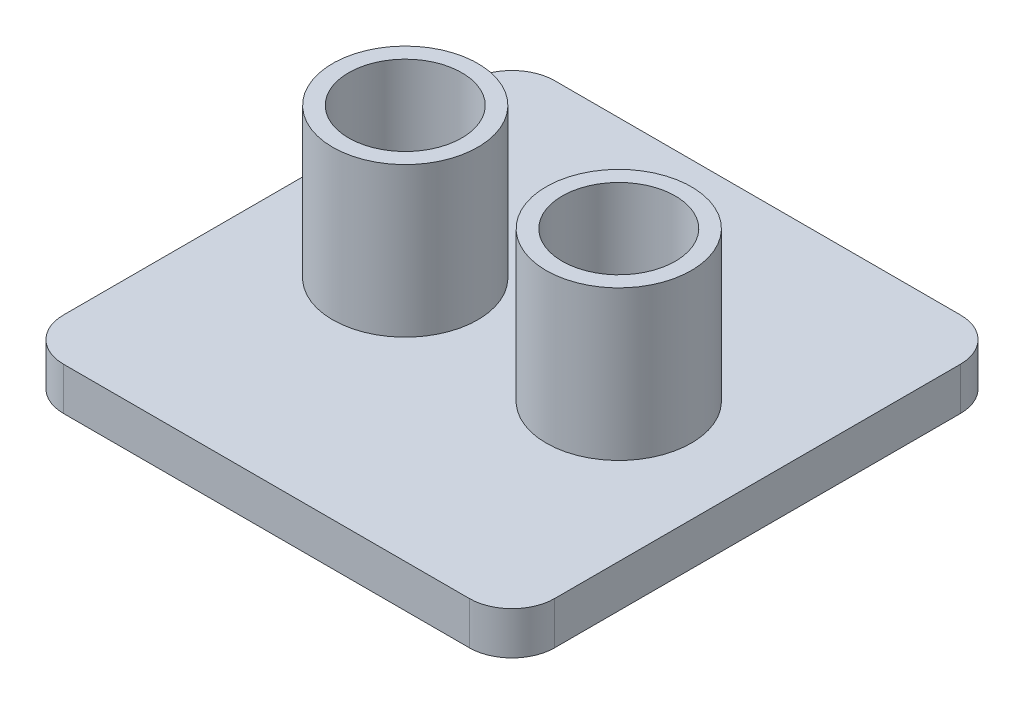
from build123d import *

# Parameters (mm, degrees)
BOSS_EXTRUDE1_DEPTH = 2
SKETCH2_R           = 3.4
BOSS_EXTRUDE2_DEPTH = 7
SKETCH3_R           = 2.65
CUT_EXTRUDE1_DEPTH  = 19.587630295


with BuildPart() as part:
    # Sketch1 → Boss-Extrude1 (new body)
    with BuildSketch(Plane(origin=(0, 0, 0), x_dir=(1, 0, 0), z_dir=(0, 1, 0))):
        with BuildLine():
            Line((-9.5, -11.5), (9.5, -11.5))
            ThreePointArc((9.5, -11.5), (10.914213562, -10.914213562), (11.5, -9.5))
            Line((11.5, -9.5), (11.5, 9.5))
            ThreePointArc((11.5, 9.5), (10.914213562, 10.914213562), (9.5, 11.5))
            Line((9.5, 11.5), (-9.5, 11.5))
            ThreePointArc((-9.5, 11.5), (-10.914213562, 10.914213562), (-11.5, 9.5))
            Line((-11.5, 9.5), (-11.5, -9.5))
            ThreePointArc((-11.5, -9.5), (-10.914213562, -10.914213562), (-9.5, -11.5))
        make_face()
    extrude(amount=BOSS_EXTRUDE1_DEPTH)

    # Sketch2 → Boss-Extrude2 (add)
    with BuildSketch(Plane(origin=(0, 2, 0), x_dir=(1, 0, 0), z_dir=(0, 1, 0))):
        with Locations(Location((-5, 0, 0), (0, 0, 270))):
            Circle(SKETCH2_R)
        with Locations(Location((5, 0, 0), (0, 0, 270))):
            Circle(SKETCH2_R)
    extrude(amount=BOSS_EXTRUDE2_DEPTH)

    # Sketch3 → Cut-Extrude1 (cut, through all)
    with BuildSketch(Plane(origin=(0, 9, 0), x_dir=(1, 0, 0), z_dir=(0, 1, 0))):
        with Locations(Location((-5, 0, 0), (0, 0, 270))):
            Circle(SKETCH3_R)
        with Locations(Location((5, 0, 0), (0, 0, 270))):
            Circle(SKETCH3_R)
    extrude(amount=-CUT_EXTRUDE1_DEPTH, mode=Mode.SUBTRACT)


solid = part.part
